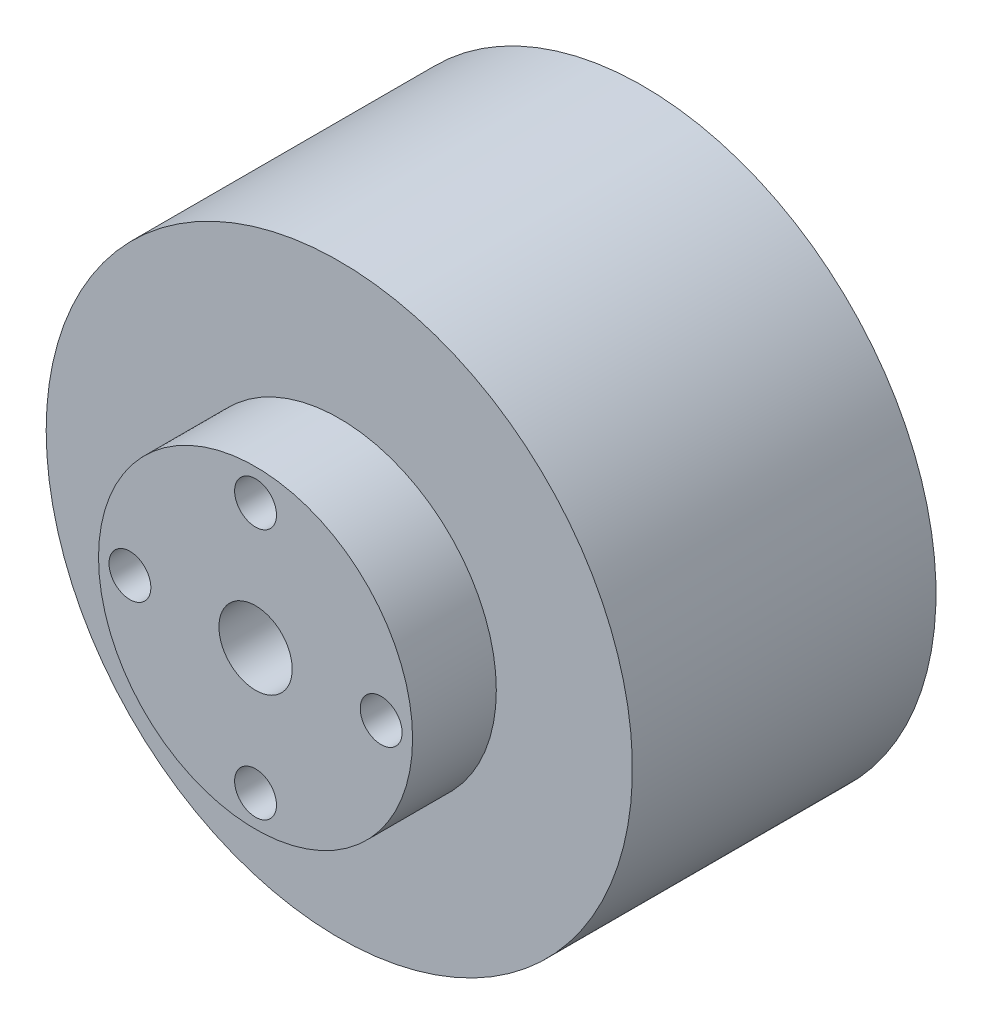
from build123d import *

# Parameters (mm, degrees)
SKETCH_1_R          = 14
EXTRUDE_1_DEPTH     = 14.5
SKETCH_3_R          = 7.5
EXTRUDE_3_DEPTH     = 4
SKETCH_4_R          = 1.75
CUT_EXTRUDE_1_DEPTH = 28.09704781
SKETCH_5_R          = 1
CUT_EXTRUDE_2_DEPTH = 3
SKETCH_6_R          = 1.5
CUT_EXTRUDE_3_DEPTH = 3


with BuildPart() as part:
    # 草图1 → 凸台-拉伸1 (new body)
    with BuildSketch(Plane.XY):
        with Locations(Location((0, 0, 0), (0, 0, 180))):
            Circle(SKETCH_1_R)
    extrude(amount=EXTRUDE_1_DEPTH)

    # 草图3 → 凸台-拉伸3 (add)
    with BuildSketch(Plane.XY.offset(14.5)):
        Circle(SKETCH_3_R)
    extrude(amount=EXTRUDE_3_DEPTH)

    # 草图4 → 切除-拉伸1 (cut, through all)
    with BuildSketch(Plane.XY.offset(18.5)):
        Circle(SKETCH_4_R)
    extrude(amount=-CUT_EXTRUDE_1_DEPTH, mode=Mode.SUBTRACT)

    # 草图5 → 切除-拉伸2 (cut)
    with BuildSketch(Plane.XY.offset(18.5)):
        with Locations((0, -6)):
            Circle(SKETCH_5_R)
        with Locations((-6, 0)):
            Circle(SKETCH_5_R)
        with Locations((0, 6)):
            Circle(SKETCH_5_R)
        with Locations((6, 0)):
            Circle(SKETCH_5_R)
    extrude(amount=-CUT_EXTRUDE_2_DEPTH, mode=Mode.SUBTRACT)

    # 草图6 → 切除-拉伸3 (cut)
    with BuildSketch(Plane.XY):
        with Locations((0, 8)):
            Circle(SKETCH_6_R)
        with Locations((-8, 0)):
            Circle(SKETCH_6_R)
        with Locations((0, -8)):
            Circle(SKETCH_6_R)
        with Locations((8, 0)):
            Circle(SKETCH_6_R)
    extrude(amount=CUT_EXTRUDE_3_DEPTH, mode=Mode.SUBTRACT)


solid = part.part
